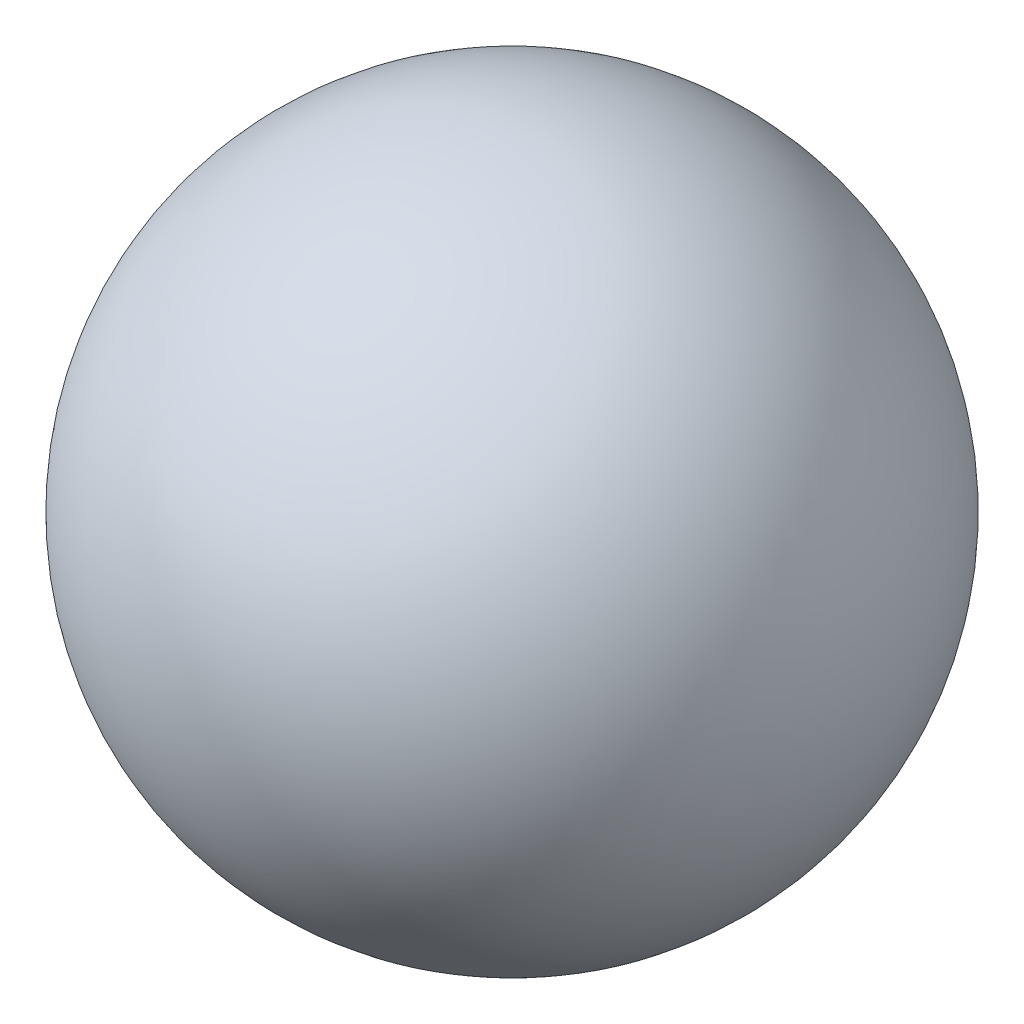
from build123d import *
from build123d.topology import SkipClean


with BuildPart() as part:
    # Croquis2 → Revolución1 (revolve)
    with SkipClean():  # the faces are left unmerged after this step: merging them gives an invalid solid
        with BuildSketch(Plane.XY):
            with BuildLine():
                ThreePointArc((5.8, 0), (4.101219331, 4.101219331), (0, 5.8))
                Line((0, 5.8), (0, -5.8))
                ThreePointArc((0, -5.8), (4.101219331, -4.101219331), (5.8, 0))
            make_face()
            with BuildLine():
                Line((0, -5.8), (0, 5.8))
                ThreePointArc((0, 5.8), (-5.8, 0), (0, -5.8))
            make_face()
        revolve(axis=Axis((0, 5.8, 0), (0, -1, 0)))


solid = part.part
